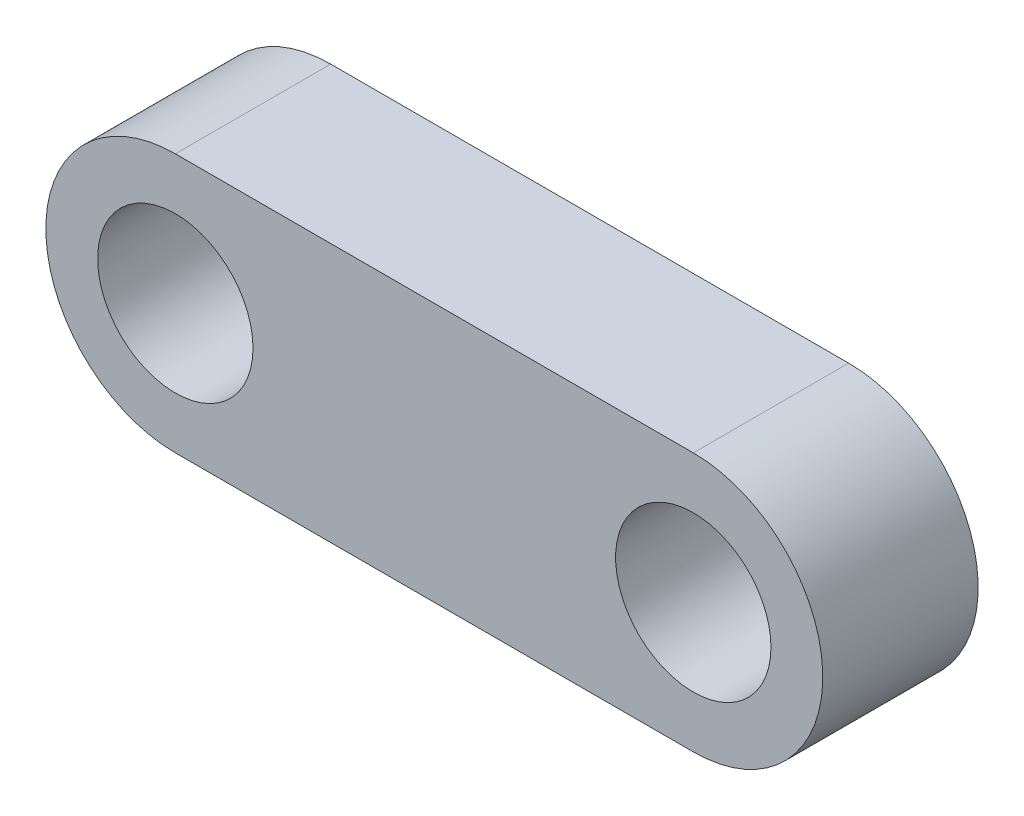
from build123d import *

# Parameters (mm, degrees)
ESQUISSE1_R        = 1.5
BOSS_EXTRU_1_DEPTH = 3


with BuildPart() as part:
    # Esquisse1 → Boss.-Extru.1 (new body)
    with BuildSketch(Plane.XY):
        with BuildLine():
            Line((-5, 2.5), (5, 2.5))
            ThreePointArc((5, 2.5), (7.5, 0), (5, -2.5))
            Line((5, -2.5), (-5, -2.5))
            ThreePointArc((-5, -2.5), (-7.5, 0), (-5, 2.5))
        make_face()
        with Locations((-5, 0)):
            Circle(ESQUISSE1_R, mode=Mode.SUBTRACT)
        with Locations((5, 0)):
            Circle(ESQUISSE1_R, mode=Mode.SUBTRACT)
    extrude(amount=BOSS_EXTRU_1_DEPTH)


solid = part.part
